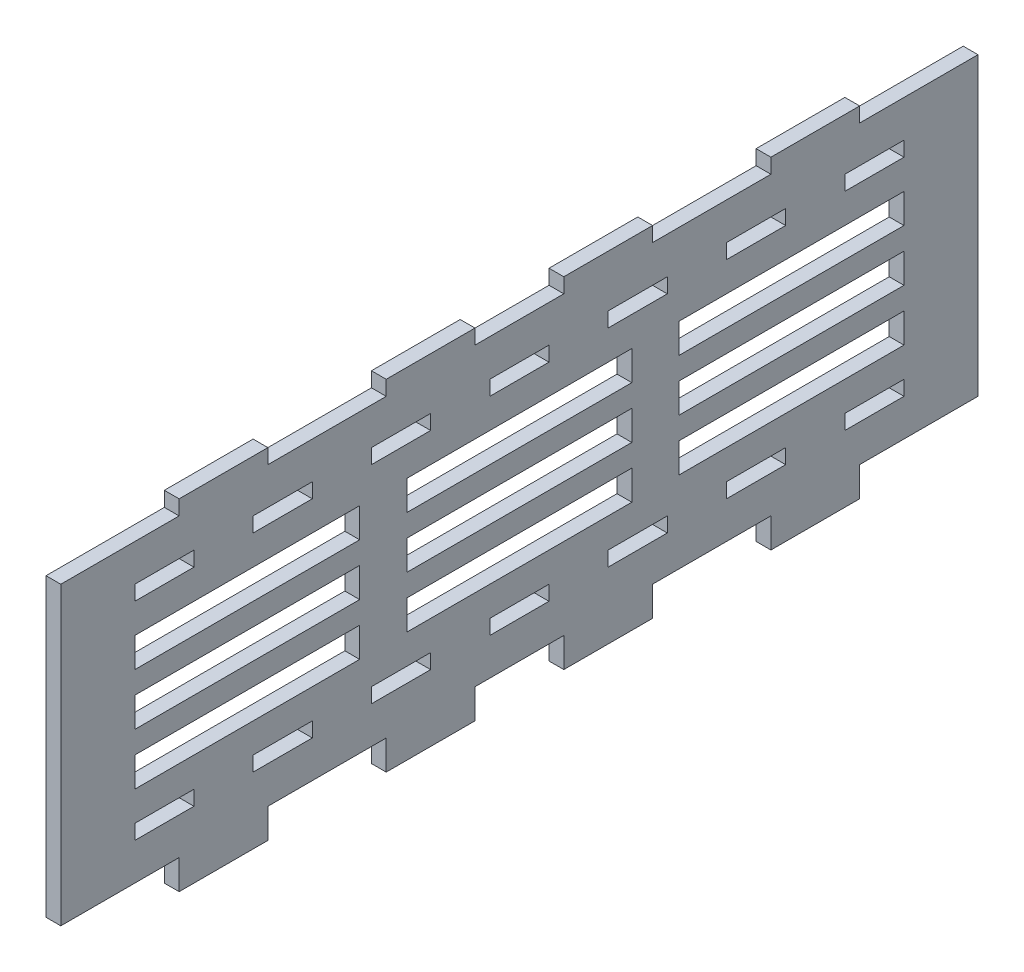
from build123d import *

# Parameters (mm, degrees)
SKETCH1_W           = 10
SKETCH1_H           = 2.5
SKETCH1_W_2         = 38
SKETCH1_H_2         = 5
BOSS_EXTRUDE1_DEPTH = 1.25


with BuildPart() as part:
    # Sketch1 → Boss-Extrude1 (new, symmetric)
    with BuildSketch(Plane(origin=(0, 0, 0), x_dir=(0, 0, -1), z_dir=(1, 0, 0))):
        Polygon((-77.50700933, 25), (-77.50700933, -25), (-57.50700933, -25), (-57.50700933, -30), (-42.50700933, -30), (-42.50700933, -25), (-22.50700933, -25), (-22.50700933, -30), (-7.50700933, -30), (-7.50700933, -25), (7.50700933, -25), (7.50700933, -30), (22.50700933, -30), (22.50700933, -25), (42.50700933, -25), (42.50700933, -30), (57.50700933, -30), (57.50700933, -25), (77.50700933, -25), (77.50700933, 25), (57.50700933, 25), (57.50700933, 27.5), (42.50700933, 27.5), (42.50700933, 25), (22.50700933, 25), (22.50700933, 27.5), (7.50700933, 27.5), (7.50700933, 25), (-7.50700933, 25), (-7.50700933, 27.5), (-22.50700933, 27.5), (-22.50700933, 25), (-42.50700933, 25), (-42.50700933, 27.5), (-57.50700933, 27.5), (-57.50700933, 25), align=None)
        with Locations((0, 17.5)):
            Rectangle(SKETCH1_W, SKETCH1_H, mode=Mode.SUBTRACT)
        with Locations((-46, -8.75)):
            Rectangle(SKETCH1_W_2, SKETCH1_H_2, mode=Mode.SUBTRACT)
        with Locations((0, -17.5)):
            Rectangle(SKETCH1_W, SKETCH1_H, mode=Mode.SUBTRACT)
        with Locations((-20, -17.5)):
            Rectangle(SKETCH1_W, SKETCH1_H, mode=Mode.SUBTRACT)
        with Locations((-20, 17.5)):
            Rectangle(SKETCH1_W, SKETCH1_H, mode=Mode.SUBTRACT)
        with Locations((-40, -17.5)):
            Rectangle(SKETCH1_W, SKETCH1_H, mode=Mode.SUBTRACT)
        with Locations((-40, 17.5)):
            Rectangle(SKETCH1_W, SKETCH1_H, mode=Mode.SUBTRACT)
        with Locations((-60, -17.5)):
            Rectangle(SKETCH1_W, SKETCH1_H, mode=Mode.SUBTRACT)
        with Locations((-60, 17.5)):
            Rectangle(SKETCH1_W, SKETCH1_H, mode=Mode.SUBTRACT)
        with Locations((20, -17.5)):
            Rectangle(SKETCH1_W, SKETCH1_H, mode=Mode.SUBTRACT)
        with Locations((20, 17.5)):
            Rectangle(SKETCH1_W, SKETCH1_H, mode=Mode.SUBTRACT)
        with Locations((40, -17.5)):
            Rectangle(SKETCH1_W, SKETCH1_H, mode=Mode.SUBTRACT)
        with Locations((40, 17.5)):
            Rectangle(SKETCH1_W, SKETCH1_H, mode=Mode.SUBTRACT)
        with Locations((60, -17.5)):
            Rectangle(SKETCH1_W, SKETCH1_H, mode=Mode.SUBTRACT)
        with Locations((60, 17.5)):
            Rectangle(SKETCH1_W, SKETCH1_H, mode=Mode.SUBTRACT)
        with Locations((0, 8.75)):
            Rectangle(SKETCH1_W_2, SKETCH1_H_2, mode=Mode.SUBTRACT)
        with Locations((46, 8.75)):
            Rectangle(SKETCH1_W_2, SKETCH1_H_2, mode=Mode.SUBTRACT)
        with Locations((-46, 0)):
            Rectangle(SKETCH1_W_2, SKETCH1_H_2, mode=Mode.SUBTRACT)
        with Locations((-46, 8.75)):
            Rectangle(SKETCH1_W_2, SKETCH1_H_2, mode=Mode.SUBTRACT)
        with Locations((46, -8.75)):
            Rectangle(SKETCH1_W_2, SKETCH1_H_2, mode=Mode.SUBTRACT)
        with Locations((46, 0)):
            Rectangle(SKETCH1_W_2, SKETCH1_H_2, mode=Mode.SUBTRACT)
        Rectangle(SKETCH1_W_2, SKETCH1_H_2, mode=Mode.SUBTRACT)
        with Locations((0, -8.75)):
            Rectangle(SKETCH1_W_2, SKETCH1_H_2, mode=Mode.SUBTRACT)
    extrude(amount=BOSS_EXTRUDE1_DEPTH, both=True)


solid = part.part
